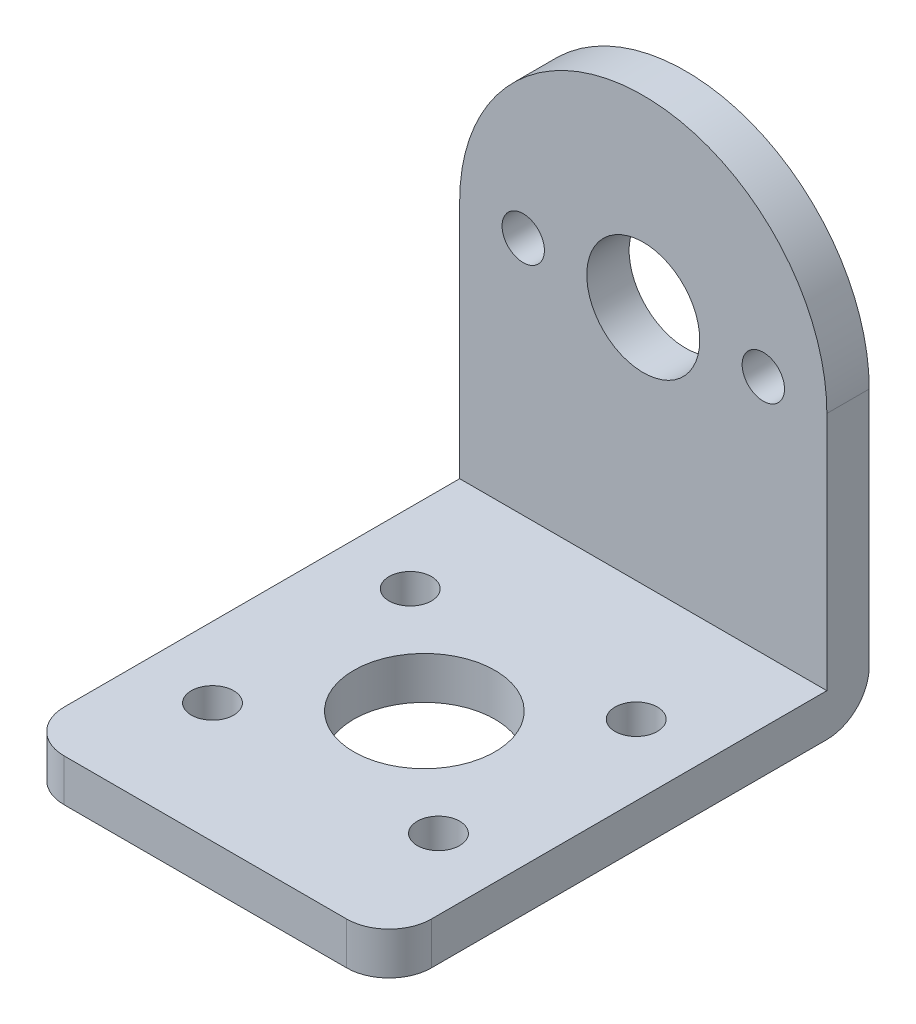
from build123d import *

# Parameters (mm, degrees)
SKETCH2_R           = 4
SKETCH2_R_2         = 1.5
BOSS_EXTRUDE1_DEPTH = 3
SKETCH3_W           = 26
SKETCH3_H           = 3
BOSS_EXTRUDE2_DEPTH = 31
SKETCH4_R           = 5
SKETCH4_R_2         = 1.5
CUT_EXTRUDE1_DEPTH  = 48.16990566
FILLET1_R           = 3
FILLET2_R           = 3


with BuildPart() as part:
    # Sketch2 → Boss-Extrude1 (new body)
    with BuildSketch(Plane.XY):
        with BuildLine():
            Line((-13, 0), (13, 0))
            Line((13, 0), (13, 20))
            ThreePointArc((13, 20), (0, 33), (-13, 20))
            Line((-13, 20), (-13, 0))
        make_face()
        with Locations((0, 20)):
            Circle(SKETCH2_R, mode=Mode.SUBTRACT)
        with Locations((-8.5, 20)):
            Circle(SKETCH2_R_2, mode=Mode.SUBTRACT)
        with Locations((8.5, 20)):
            Circle(SKETCH2_R_2, mode=Mode.SUBTRACT)
    extrude(amount=BOSS_EXTRUDE1_DEPTH)

    # Sketch3 → Boss-Extrude2 (add)
    with BuildSketch(Plane.XY.offset(3)):
        with Locations((0, 1.5)):
            Rectangle(SKETCH3_W, SKETCH3_H)
    extrude(amount=BOSS_EXTRUDE2_DEPTH)

    # Sketch4 → Cut-Extrude1 (cut, through all)
    with BuildSketch(Plane(origin=(0, 3, 0), x_dir=(1, 0, 0), z_dir=(0, 1, 0))):
        with Locations(Location((0, -18.5, 0), (0, 0, 180))):
            Circle(SKETCH4_R)
        with Locations(Location((-8, -11.5, 0), (0, 0, 180))):
            Circle(SKETCH4_R_2)
        with Locations(Location((8, -11.5, 0), (0, 0, 180))):
            Circle(SKETCH4_R_2)
        with Locations(Location((8, -25.5, 0), (0, 0, 180))):
            Circle(SKETCH4_R_2)
        with Locations(Location((-8, -25.5, 0), (0, 0, 180))):
            Circle(SKETCH4_R_2)
    extrude(amount=-CUT_EXTRUDE1_DEPTH, mode=Mode.SUBTRACT)

    # Fillet1
    fillet1_edges = [part.edges().sort_by_distance(p)[0] for p in [
        (-13, 1.5, 34),
        (13, 1.5, 34),
    ]]
    fillet(fillet1_edges, radius=FILLET1_R)

    # Fillet2
    fillet2_edges = [part.edges().sort_by_distance(p)[0] for p in [
        (0, 0, 0),
    ]]
    fillet(fillet2_edges, radius=FILLET2_R)


solid = part.part
